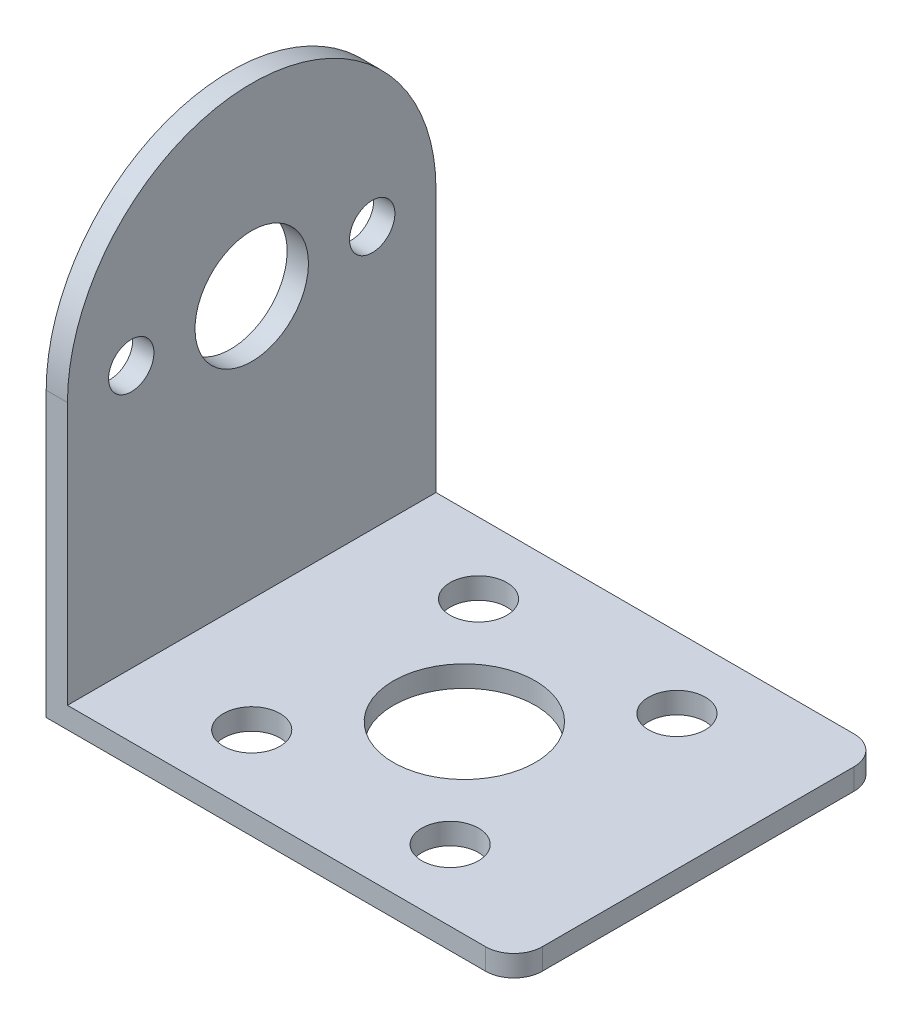
from build123d import *

# Parameters (mm, degrees)
BOSS_EXTRUDE1_DEPTH = 26
FILLET1_R           = 2
SKETCH3_R           = 5
SKETCH3_R_2         = 2
CUT_EXTRUDE1_DEPTH  = 53.509522946
SKETCH4_R           = 4
SKETCH4_R_2         = 1.6
CUT_EXTRUDE2_DEPTH  = 53.509522946


with BuildPart() as part:
    # Sketch2 → Boss-Extrude1 (new body)
    with BuildSketch(Plane.XY):
        Polygon((0, 0), (33, 0), (33, 1.5), (1.5, 1.5), (1.5, 33), (0, 33), align=None)
    extrude(amount=BOSS_EXTRUDE1_DEPTH)

    # Fillet1
    fillet1_edges = [part.edges().sort_by_distance(p)[0] for p in [
        (33, 0.75, 26),
        (33, 0.75, 0),
    ]]
    fillet(fillet1_edges, radius=FILLET1_R)

    # Sketch3 → Cut-Extrude1 (cut, through all)
    with BuildSketch(Plane(origin=(0, 1.5, 0), x_dir=(1, 0, 0), z_dir=(0, 1, 0))):
        with Locations(Location((16.5, -13, 0), (0, 0, 180))):
            Circle(SKETCH3_R)
        with Locations(Location((9.5, -5, 0), (0, 0, 180))):
            Circle(SKETCH3_R_2)
        with Locations(Location((23.5, -5, 0), (0, 0, 180))):
            Circle(SKETCH3_R_2)
        with Locations(Location((23.5, -21, 0), (0, 0, 180))):
            Circle(SKETCH3_R_2)
        with Locations(Location((9.5, -21, 0), (0, 0, 180))):
            Circle(SKETCH3_R_2)
    extrude(amount=-CUT_EXTRUDE1_DEPTH, mode=Mode.SUBTRACT)

    # Sketch4 → Cut-Extrude2 (cut, through all)
    with BuildSketch(Plane(origin=(1.5, 0, 0), x_dir=(0, 0, -1), z_dir=(1, 0, 0))):
        with Locations(Location((-13, 20, 0), (0, 0, 90))):
            Circle(SKETCH4_R)
        with Locations(Location((-21.5, 20, 0), (0, 0, 90))):
            Circle(SKETCH4_R_2)
        with Locations(Location((-4.5, 20, 0), (0, 0, 90))):
            Circle(SKETCH4_R_2)
        with BuildLine():
            Line((-26, 20), (-26, 38.59710215))
            Line((-26, 38.59710215), (0, 38.59710215))
            Line((0, 38.59710215), (0, 20))
            ThreePointArc((0, 20), (-13, 33), (-26, 20))
        make_face()
    extrude(amount=-CUT_EXTRUDE2_DEPTH, mode=Mode.SUBTRACT)


solid = part.part
